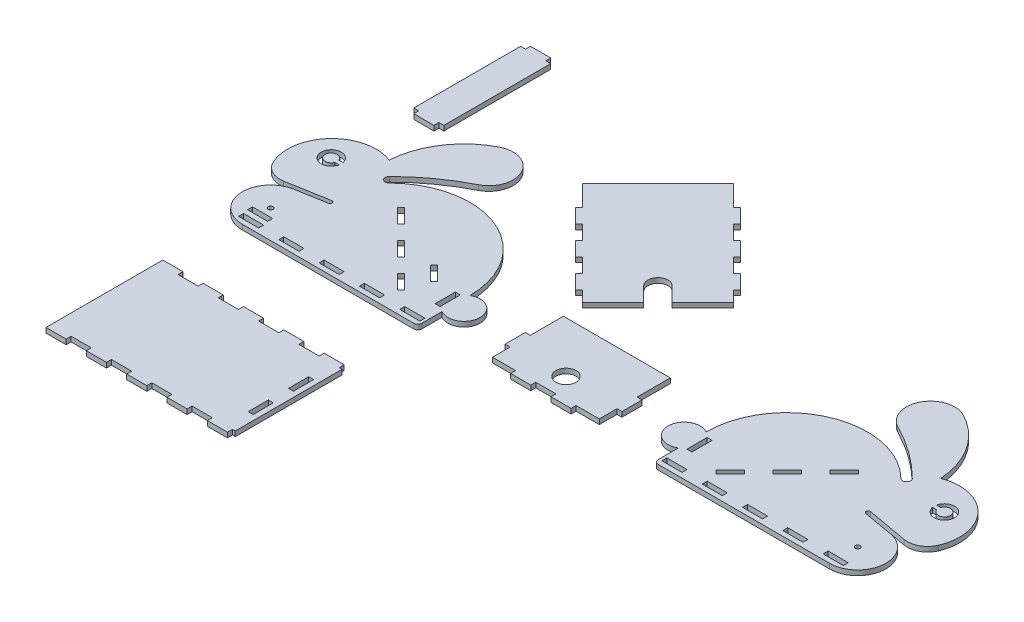
from build123d import *

# Parameters (mm, degrees)
SKETCH16_R            = 1.524
SKETCH16_W            = 12.7
SKETCH16_H            = 3.1242
SKETCH16_W_2          = 3.1242
SKETCH16_H_2          = 12.7
BOSS_EXTRUDE2_DEPTH   = 3.1242
BOSS_EXTRUDE2_2_DEPTH = 3.1242
BOSS_EXTRUDE2_3_DEPTH = 3.1242
SKETCH16_R_2          = 6.35
BOSS_EXTRUDE2_4_DEPTH = 3.1242
BOSS_EXTRUDE2_5_DEPTH = 3.1242
BOSS_EXTRUDE2_6_DEPTH = 3.1242


with BuildPart() as part:
    # Sketch16 → Boss-Extrude2 (new body)
    with BuildSketch(Plane(origin=(0, 0, 0), x_dir=(1, 0, 0), z_dir=(0, 1, 0))):
        with BuildLine():
            Line((-61.349740805, -19.32673519), (-35.567943275, -14.780708674))
            ThreePointArc((-35.567943275, -14.780708674), (-34.096704243, -15.810881335), (-35.126876904, -17.282120367))
            Line((-35.126876904, -17.282120367), (-53.887464599, -20.590118151))
            ThreePointArc((-53.887464599, -20.590118151), (-68.512341732, -39.649629106), (-50.8, -55.88))
            Line((-50.8, -55.88), (57.15, -55.88))
            ThreePointArc((57.15, -55.88), (58.946051224, -55.136051224), (59.69, -53.34))
            Line((59.69, -53.34), (59.69, -40.64))
            ThreePointArc((59.69, -40.64), (74.93, -31.841181898), (59.69, -23.042363795))
            ThreePointArc((59.69, -23.042363795), (28.330318364, 23.890716456), (-27.031024484, 12.878660689))
            ThreePointArc((-27.031024484, 12.878660689), (-30.623126933, 12.878660689), (-30.623126933, 16.470763138))
            ThreePointArc((-30.623126933, 16.470763138), (-15.294458343, 29.540157862), (1.907841878, 40.021475828))
            ThreePointArc((1.907841878, 40.021475828), (8.637643659, 60.496459784), (-11.837340297, 67.226261564))
            ThreePointArc((-11.837340297, 67.226261564), (-31.23613579, 50.004716571), (-39.603383054, 25.451019259))
            ThreePointArc((-39.603383054, 25.451019259), (-69.886632847, 18.61484801), (-75.159732124, -11.97931613))
            ThreePointArc((-75.159732124, -11.97931613), (-69.520219899, -18.031590855), (-61.349740805, -19.32673519))
        make_face()
        with Locations(Location((-50.8, -38.1, 0), (0, 0, 270))):
            Circle(SKETCH16_R, mode=Mode.SUBTRACT)
        with Locations((26.154742857, -51.1937)):
            Rectangle(SKETCH16_W, SKETCH16_H, mode=Mode.SUBTRACT)
        with Locations((51.554742857, -51.1937)):
            Rectangle(SKETCH16_W, SKETCH16_H, mode=Mode.SUBTRACT)
        with Locations((54.780542857, -32.1437)):
            Rectangle(SKETCH16_W_2, SKETCH16_H_2, mode=Mode.SUBTRACT)
        with Locations((-50.045257143, -51.1937)):
            Rectangle(SKETCH16_W, SKETCH16_H, mode=Mode.SUBTRACT)
        with Locations((-24.645257143, -51.1937)):
            Rectangle(SKETCH16_W, SKETCH16_H, mode=Mode.SUBTRACT)
        with Locations((0.754742857, -51.1937)):
            Rectangle(SKETCH16_W, SKETCH16_H, mode=Mode.SUBTRACT)
        Polygon((6.826439736, -15.919718522), (15.806695857, -24.899974643), (18.015838863, -22.690831637), (9.035582741, -13.710575516), align=None, mode=Mode.SUBTRACT)
        Polygon((-8.924929501, 4.249936726), (-11.134072506, 2.040793721), (-2.153816385, -6.9394624), (0.05532662, -4.730319395), align=None, mode=Mode.SUBTRACT)
        with BuildLine():
            Line((-55.426820149, 9.561240294), (-52.797218651, 9.561240294))
            ThreePointArc((-52.797218651, 9.561240294), (-65.368922598, 8.291240294), (-52.797218651, 7.021240294))
            Line((-52.797218651, 7.021240294), (-55.426820149, 7.021240294))
            ThreePointArc((-55.426820149, 7.021240294), (-62.828922598, 8.291240294), (-55.426820149, 9.561240294))
        make_face(mode=Mode.SUBTRACT)
        Polygon((33.767208099, -42.860486885), (35.976351105, -40.651343879), (26.996094984, -31.671087758), (24.786951978, -33.880230764), align=None, mode=Mode.SUBTRACT)
        with Locations((-50.8, -44.7421)):
            Rectangle(SKETCH16_W, SKETCH16_H, mode=Mode.SUBTRACT)
        Polygon((30.767802554, -18.919124066), (32.97694556, -16.70998106), (41.957201681, -25.690237181), (39.748058676, -27.899380187), align=None, mode=Mode.SUBTRACT)
    extrude(amount=BOSS_EXTRUDE2_DEPTH)


with BuildPart() as body_2:
    # Sketch16 → Boss-Extrude2 2 (new body)
    with BuildSketch(Plane(origin=(0, 0, 0), x_dir=(1, 0, 0), z_dir=(0, 1, 0))):
        with BuildLine():
            Line((303.77742899, -14.780708674), (329.55922652, -19.32673519))
            ThreePointArc((329.55922652, -19.32673519), (337.729705614, -18.031590855), (343.369217838, -11.97931613))
            ThreePointArc((343.369217838, -11.97931613), (338.096118561, 18.61484801), (307.812868768, 25.451019259))
            ThreePointArc((307.812868768, 25.451019259), (299.445621504, 50.004716571), (280.046826012, 67.226261564))
            ThreePointArc((280.046826012, 67.226261564), (259.571842056, 60.496459784), (266.301643836, 40.021475828))
            ThreePointArc((266.301643836, 40.021475828), (283.503944057, 29.540157862), (298.832612647, 16.470763138))
            ThreePointArc((298.832612647, 16.470763138), (298.832612647, 12.878660689), (295.240510199, 12.878660689))
            ThreePointArc((295.240510199, 12.878660689), (239.87916735, 23.890716456), (208.519485714, -23.042363795))
            ThreePointArc((208.519485714, -23.042363795), (193.279485714, -31.841181898), (208.519485714, -40.64))
            Line((208.519485714, -40.64), (208.519485714, -53.34))
            ThreePointArc((208.519485714, -53.34), (209.26343449, -55.136051224), (211.059485714, -55.88))
            Line((211.059485714, -55.88), (319.009485714, -55.88))
            ThreePointArc((319.009485714, -55.88), (336.721827446, -39.649629106), (322.096950313, -20.590118151))
            Line((322.096950313, -20.590118151), (303.336362618, -17.282120367))
            ThreePointArc((303.336362618, -17.282120367), (302.306189958, -15.810881335), (303.77742899, -14.780708674))
        make_face()
        with Locations(Location((319.009485714, -38.1, 0), (0, 0, 270))):
            Circle(SKETCH16_R, mode=Mode.SUBTRACT)
        with BuildLine():
            Line((323.636305864, 7.021240294), (321.006704366, 7.021240294))
            ThreePointArc((321.006704366, 7.021240294), (333.578408312, 8.291240294), (321.006704366, 9.561240294))
            Line((321.006704366, 9.561240294), (323.636305864, 9.561240294))
            ThreePointArc((323.636305864, 9.561240294), (331.038408312, 8.291240294), (323.636305864, 7.021240294))
        make_face(mode=Mode.SUBTRACT)
        Polygon((232.23313461, -40.651343879), (234.442277615, -42.860486885), (243.422533736, -33.880230764), (241.213390731, -31.671087758), align=None, mode=Mode.SUBTRACT)
        with Locations((292.854742857, -51.1937)):
            Rectangle(SKETCH16_W, SKETCH16_H, mode=Mode.SUBTRACT)
        with Locations((318.254742857, -51.1937)):
            Rectangle(SKETCH16_W, SKETCH16_H, mode=Mode.SUBTRACT)
        Polygon((277.134415215, 4.249936726), (268.154159094, -4.730319395), (270.3633021, -6.9394624), (279.343558221, 2.040793721), align=None, mode=Mode.SUBTRACT)
        Polygon((250.193646852, -22.690831637), (252.402789858, -24.899974643), (261.383045979, -15.919718522), (259.173902973, -13.710575516), align=None, mode=Mode.SUBTRACT)
        with Locations((213.428942857, -32.1437)):
            Rectangle(SKETCH16_W_2, SKETCH16_H_2, mode=Mode.SUBTRACT)
        with Locations((216.654742857, -51.1937)):
            Rectangle(SKETCH16_W, SKETCH16_H, mode=Mode.SUBTRACT)
        with Locations((242.054742857, -51.1937)):
            Rectangle(SKETCH16_W, SKETCH16_H, mode=Mode.SUBTRACT)
        with Locations((267.454742857, -51.1937)):
            Rectangle(SKETCH16_W, SKETCH16_H, mode=Mode.SUBTRACT)
    extrude(amount=BOSS_EXTRUDE2_2_DEPTH)


with BuildPart() as body_3:
    # Sketch16 → Boss-Extrude2 3 (new body)
    with BuildSketch(Plane(origin=(0, 0, 0), x_dir=(1, 0, 0), z_dir=(0, 1, 0))):
        Polygon((-43.695257143, -173.99), (-43.695257143, -170.8658), (-30.995257143, -170.8658), (-30.995257143, -173.99), (-18.295257143, -173.99), (-18.295257143, -170.8658), (-5.595257143, -170.8658), (-5.595257143, -173.99), (7.104742857, -173.99), (7.104742857, -170.8658), (19.804742857, -170.8658), (19.804742857, -173.99), (32.504742857, -173.99), (32.504742857, -170.8658), (45.204742857, -170.8658), (45.204742857, -173.99), (57.904742857, -173.99), (57.904742857, -170.8658), (59.69, -170.8658), (59.69, -103.5558), (57.904742857, -103.5558), (57.904742857, -100.4316), (45.204742857, -100.4316), (45.204742857, -103.5558), (32.504742857, -103.5558), (32.504742857, -100.4316), (19.804742857, -100.4316), (19.804742857, -103.5558), (7.104742857, -103.5558), (7.104742857, -100.4316), (-5.595257143, -100.4316), (-5.595257143, -103.5558), (-18.295257143, -103.5558), (-18.295257143, -100.4316), (-30.995257143, -100.4316), (-30.995257143, -103.5558), (-43.695257143, -103.5558), (-43.695257143, -100.4316), (-56.395257143, -100.4316), (-56.395257143, -103.5558), (-56.395257143, -170.8658), (-56.395257143, -173.99), align=None)
        with Locations((54.780542857, -124.5108)):
            Rectangle(SKETCH16_W_2, SKETCH16_H_2, mode=Mode.SUBTRACT)
        with Locations((54.780542857, -149.9108)):
            Rectangle(SKETCH16_W_2, SKETCH16_H_2, mode=Mode.SUBTRACT)
    extrude(amount=BOSS_EXTRUDE2_3_DEPTH)


with BuildPart() as body_4:
    # Sketch16 → Boss-Extrude2 4 (new body)
    with BuildSketch(Plane(origin=(0, 0, 0), x_dir=(1, 0, 0), z_dir=(0, 1, 0))):
        Polygon((127.754742857, -49.6316), (140.454742857, -49.6316), (140.454742857, -52.7558), (153.154742857, -52.7558), (153.154742857, -49.6316), (167.759742857, -49.6316), (167.759742857, -38.4937), (170.883942857, -38.4937), (170.883942857, -25.7937), (167.759742857, -25.7937), (167.759742857, -4.907130522), (100.449742857, -4.907130522), (100.449742857, -25.7937), (97.325542857, -25.7937), (97.325542857, -38.4937), (100.449742857, -38.4937), (100.449742857, -49.6316), (115.054742857, -49.6316), (115.054742857, -52.7558), (127.754742857, -52.7558), align=None)
        with Locations(Location((134.104742857, -36.9316, 0), (0, 0, 270))):
            Circle(SKETCH16_R_2, mode=Mode.SUBTRACT)
    extrude(amount=BOSS_EXTRUDE2_4_DEPTH)


with BuildPart() as body_5:
    # Sketch16 → Boss-Extrude2 5 (new body)
    with BuildSketch(Plane(origin=(0, 0, 0), x_dir=(1, 0, 0), z_dir=(0, 1, 0))):
        with BuildLine():
            Line((121.701876036, 80.995205537), (123.911019042, 83.204348543))
            Line((123.911019042, 83.204348543), (114.930762921, 92.184604664))
            Line((114.930762921, 92.184604664), (112.721619915, 89.975461658))
            Line((112.721619915, 89.975461658), (103.741363794, 98.955717779))
            Line((103.741363794, 98.955717779), (105.9505068, 101.164860785))
            Line((105.9505068, 101.164860785), (96.970250679, 110.145116906))
            Line((96.970250679, 110.145116906), (94.761107673, 107.9359739))
            Line((94.761107673, 107.9359739), (81.707632665, 120.989448908))
            Line((81.707632665, 120.989448908), (34.112275223, 73.394091467))
            Line((34.112275223, 73.394091467), (47.165750232, 60.340616459))
            Line((47.165750232, 60.340616459), (44.956607226, 58.131473453))
            Line((44.956607226, 58.131473453), (53.936863347, 49.151217332))
            Line((53.936863347, 49.151217332), (56.146006353, 51.360360338))
            Line((56.146006353, 51.360360338), (65.126262474, 42.380104216))
            Line((65.126262474, 42.380104216), (62.917119468, 40.170961211))
            Line((62.917119468, 40.170961211), (71.897375589, 31.19070509))
            Line((71.897375589, 31.19070509), (74.106518595, 33.399848095))
            Line((74.106518595, 33.399848095), (83.086774716, 24.419591974))
            Line((83.086774716, 24.419591974), (80.87763171, 22.210448969))
            Line((80.87763171, 22.210448969), (89.857887831, 13.230192847))
            Line((89.857887831, 13.230192847), (92.067030837, 15.439335853))
            Line((92.067030837, 15.439335853), (98.838143952, 8.668222738))
            Line((98.838143952, 8.668222738), (118.145694612, 27.975773398))
            Line((118.145694612, 27.975773398), (109.165438491, 36.956029519))
            ThreePointArc((109.165438491, 36.956029519), (109.165438491, 45.93628564), (118.145694612, 45.93628564))
            Line((118.145694612, 45.93628564), (127.125950734, 36.956029519))
            Line((127.125950734, 36.956029519), (146.433501394, 56.26358018))
            Line((146.433501394, 56.26358018), (139.662388279, 63.034693295))
            Line((139.662388279, 63.034693295), (141.871531284, 65.243836301))
            Line((141.871531284, 65.243836301), (132.891275163, 74.224092422))
            Line((132.891275163, 74.224092422), (130.682132157, 72.014949416))
            Line((130.682132157, 72.014949416), (121.701876036, 80.995205537))
        make_face()
    extrude(amount=BOSS_EXTRUDE2_5_DEPTH)


with BuildPart() as body_6:
    # Sketch16 → Boss-Extrude2 6 (new body)
    with BuildSketch(Plane(origin=(0, 0, 0), x_dir=(1, 0, 0), z_dir=(0, 1, 0))):
        Polygon((-60.2742, 128.8542), (-60.2742, 61.5442), (-57.15, 61.5442), (-57.15, 58.42), (-44.45, 58.42), (-44.45, 61.5442), (-41.3258, 61.5442), (-41.3258, 128.8542), (-44.45, 128.8542), (-44.45, 131.9784), (-57.15, 131.9784), (-57.15, 128.8542), align=None)
    extrude(amount=BOSS_EXTRUDE2_6_DEPTH)


solid = Compound([part.part, body_2.part, body_3.part, body_4.part, body_5.part, body_6.part])
